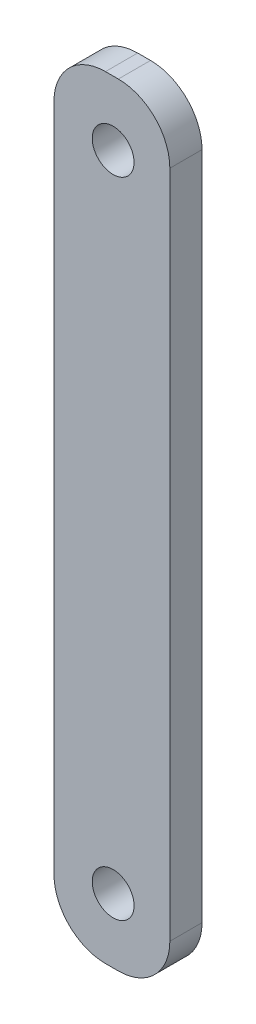
from build123d import *

# Parameters (mm, degrees)
SKETCH_1_W          = 18
SKETCH_1_H          = 120
EXTRUDE_1_DEPTH     = 5
SKETCH_2_R          = 3.25
CUT_EXTRUDE_1_DEPTH = 30
FILLET_1_R          = 8


with BuildPart() as part:
    # 스케치1 → 보스-돌출1 (new body)
    with BuildSketch(Plane.XY):
        with Locations((-0.193251534, 50.955788216)):
            Rectangle(SKETCH_1_W, SKETCH_1_H)
    extrude(amount=EXTRUDE_1_DEPTH)

    # 스케치2 → 컷-돌출1 (cut)
    with BuildSketch(Plane.XY.offset(5)):
        with Locations((0, 100.955788216)):
            Circle(SKETCH_2_R)
        with Locations((0, 0.955788216)):
            Circle(SKETCH_2_R)
    extrude(amount=-CUT_EXTRUDE_1_DEPTH, mode=Mode.SUBTRACT)

    # 필렛1
    fillet_1_edges = [part.edges().sort_by_distance(p)[0] for p in [
        (-9.193251534, 110.955788216, 2.5),
        (-9.193251534, -9.044211784, 2.5),
        (8.806748466, -9.044211784, 2.5),
        (8.806748466, 110.955788216, 2.5),
    ]]
    fillet(fillet_1_edges, radius=FILLET_1_R)


solid = part.part
